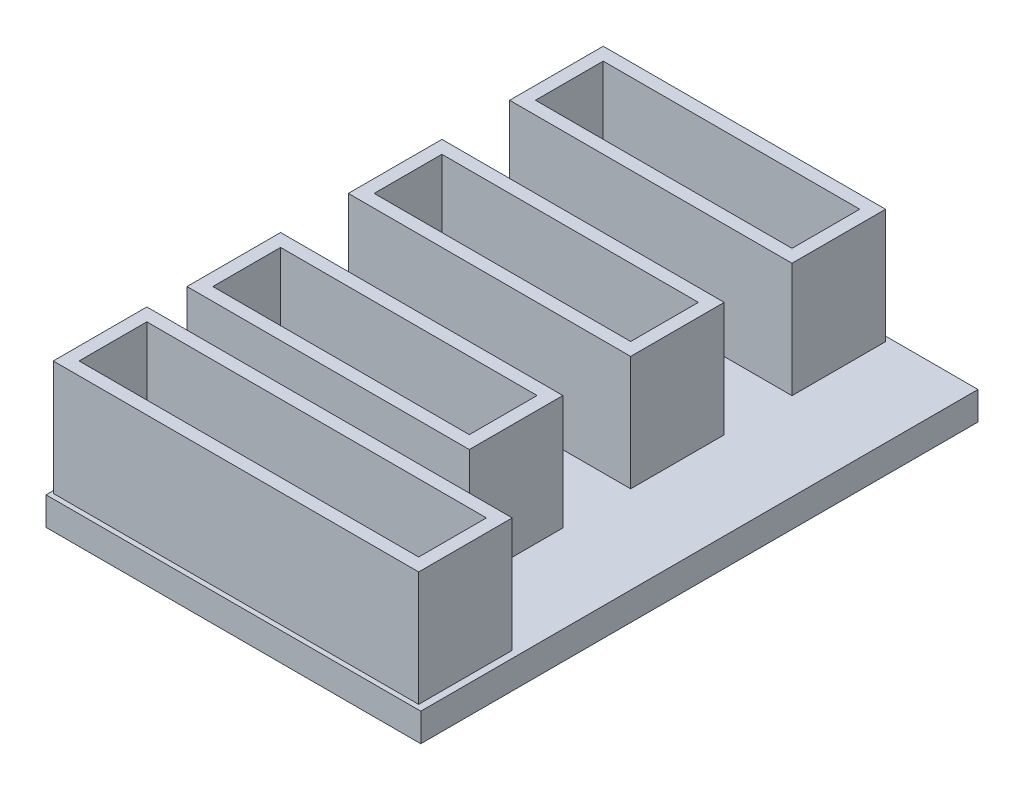
from build123d import *

# Parameters (mm, degrees)
SKETCH2_W           = 23.23
SKETCH2_H           = 34.54
BOSS_EXTRUDE1_DEPTH = 1.75
SKETCH3_W           = 17.5
SKETCH3_H           = 5.8
BOSS_EXTRUDE2_DEPTH = 7.11
SHELL2_T            = -0.8
LPATTERN1_COUNT     = 3
LPATTERN1_PITCH     = 10
SKETCH4_W           = 22.65
SKETCH4_H           = 5.8
BOSS_EXTRUDE3_DEPTH = 7.11
SHELL3_T            = -0.8
SHELL4_T            = -0.8
SHELL5_T            = -0.8


with BuildPart() as part:
    # Sketch2 → Boss-Extrude1 (new body)
    with BuildSketch(Plane(origin=(0, 0, 0), x_dir=(1, 0, 0), z_dir=(0, 1, 0))):
        Rectangle(SKETCH2_W, SKETCH2_H)
    extrude(amount=-BOSS_EXTRUDE1_DEPTH)


with BuildPart() as body_2:
    # Sketch3 → Boss-Extrude2 (new body)
    with BuildSketch(Plane(origin=(0, 0, 0), x_dir=(1, 0, 0), z_dir=(0, 1, 0))):
        with Locations((-2.565, 14.07)):
            Rectangle(SKETCH3_W, SKETCH3_H)
    boss_extrude2 = extrude(amount=BOSS_EXTRUDE2_DEPTH)

    # Shell2
    shell2_openings = [body_2.faces().sort_by_distance(p)[0] for p in [
        (-2.565, 7.11, -14.07),
    ]]
    offset(amount=SHELL2_T, openings=shell2_openings, kind=Kind.INTERSECTION)


with BuildPart() as lpattern1_1:
    # LPattern1: pattern copy
    add(boss_extrude2.moved(Location(Vector(0, 0, 1) * (1 * LPATTERN1_PITCH))))

    # Shell3
    shell3_openings = [lpattern1_1.faces().sort_by_distance(p)[0] for p in [
        (-2.565, 7.11, -4.07),
    ]]
    offset(amount=SHELL3_T, openings=shell3_openings, kind=Kind.INTERSECTION)


with BuildPart() as lpattern1_2:
    # LPattern1: pattern copy
    add(boss_extrude2.moved(Location(Vector(0, 0, 1) * (2 * LPATTERN1_PITCH))))

    # Shell4
    shell4_openings = [lpattern1_2.faces().sort_by_distance(p)[0] for p in [
        (-2.565, 7.11, 5.93),
    ]]
    offset(amount=SHELL4_T, openings=shell4_openings, kind=Kind.INTERSECTION)


with BuildPart() as body_5:
    # Sketch4 → Boss-Extrude3 (new body)
    with BuildSketch(Plane(origin=(0, 0, 0), x_dir=(1, 0, 0), z_dir=(0, 1, 0))):
        with Locations((-0.14, -14.07)):
            Rectangle(SKETCH4_W, SKETCH4_H)
    extrude(amount=BOSS_EXTRUDE3_DEPTH)

    # Shell5
    shell5_openings = [body_5.faces().sort_by_distance(p)[0] for p in [
        (-0.14, 7.11, 14.07),
    ]]
    offset(amount=SHELL5_T, openings=shell5_openings, kind=Kind.INTERSECTION)


solid = Compound([part.part, body_2.part, lpattern1_1.part, lpattern1_2.part, body_5.part])
